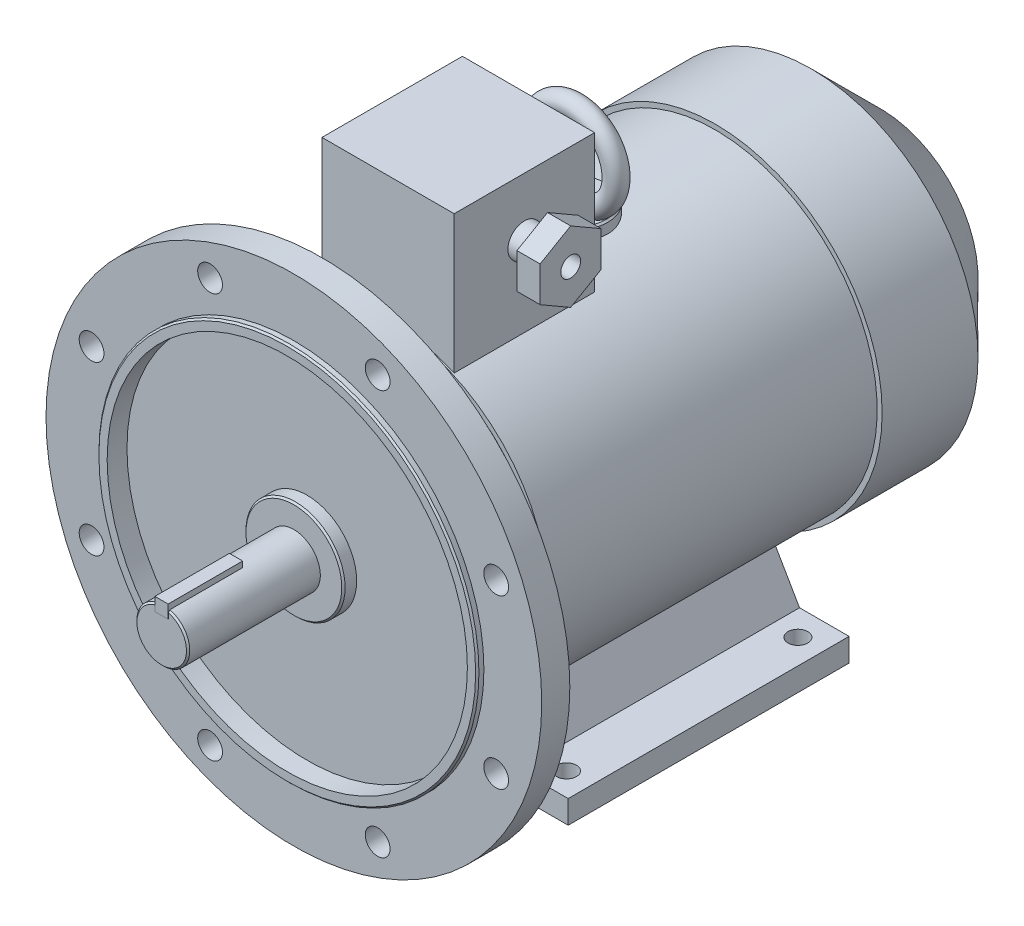
from build123d import *

# Parameters (mm, degrees)
SKETCH_1_R           = 16
EXTRUDE_1_DEPTH      = 80
SKETCH_2_R           = 150
EXTRUDE_2_DEPTH      = 17
EXTRUDE_3_DEPTH      = 0.1
EXTRUDE_3_DEPTH_BACK = 45
SKETCH_3_W           = 8
SKETCH_3_H           = 8
SKETCH_4_R           = 115
SKETCH_4_R_2         = 109
EXTRUDE_4_DEPTH      = 4
CUT_EXTRUDE_START    = -8
SKETCH_5_R           = 109
SKETCH_5_R_2         = 30
CUT_EXTRUDE_1_DEPTH  = 8
CHAMFER_1_SIZE       = 1
SKETCH_6_R           = 7.5
CUT_EXTRUDE_2_DEPTH  = 227.750986767
SKETCH_7_R           = 95
EXTRUDE_5_DEPTH      = 39
SKETCH_8_R           = 98
EXTRUDE_6_DEPTH      = 199
SKETCH_9_R           = 101
EXTRUDE_7_DEPTH      = 100
CHAMFER_2_SIZE       = 42
EXTRUDE_8_DEPTH      = 170
CUT_EXTRUDE_3_REACH  = 468.014
SKETCH_11_R          = 6
SKETCH_12_W          = 80
SKETCH_12_H          = 85
EXTRUDE_9_DEPTH      = 173
SKETCH_13_R          = 20
EXTRUDE_10_DEPTH     = 103
CHAMFER_3_SIZE       = 1
SKETCH_15_R          = 6
SKETCH_16_R          = 10
EXTRUDE_11_DEPTH     = 14
EXTRUDE_12_DEPTH     = 14
SKETCH_18_R          = 6
CUT_EXTRUDE_4_DEPTH  = 14


with BuildPart() as part:
    # Эскиз1 → Вытянуть1 (new body)
    with BuildSketch(Plane.XY):
        Circle(SKETCH_1_R)
    extrude(amount=EXTRUDE_1_DEPTH)

    # Эскиз2 → Вытянуть2 (add)
    with BuildSketch(Plane(origin=(0, 0, 0), x_dir=(-1, 0, 0), z_dir=(0, 0, -1))):
        Circle(SKETCH_2_R)
    extrude(amount=EXTRUDE_2_DEPTH)

    # Эскиз3 → Вытянуть3 (add, two sides: drawn at the far end of the back side and taken through both)
    with BuildSketch(Plane.XY.offset(80).offset(-EXTRUDE_3_DEPTH_BACK)):
        with Locations((0, 15)):
            Rectangle(SKETCH_3_W, SKETCH_3_H)
    extrude(amount=EXTRUDE_3_DEPTH + EXTRUDE_3_DEPTH_BACK)

    # Эскиз4 → Вытянуть4 (add)
    with BuildSketch(Plane.XY):
        with Locations(Location((0, 0, 0), (0, 0, 180))):
            Circle(SKETCH_4_R)
        Circle(SKETCH_4_R_2, mode=Mode.SUBTRACT)
    extrude(amount=EXTRUDE_4_DEPTH)

    # Эскиз5 → Вырез-Вытянуть1 (cut)
    with BuildSketch(Plane.XY.offset(CUT_EXTRUDE_START)):
        Circle(SKETCH_5_R)
        Circle(SKETCH_5_R_2, mode=Mode.SUBTRACT)
    extrude(amount=CUT_EXTRUDE_1_DEPTH, mode=Mode.SUBTRACT)

    # Фаска1
    chamfer_1_edges = [part.edges().sort_by_distance(p)[0] for p in [
        (115, 0, 4),
        (-30, 0, 0),
        (-9.797958971, -12.649110641, 80),
    ]]
    chamfer(chamfer_1_edges, length=CHAMFER_1_SIZE)

    # Эскиз6 → Вырез-Вытянуть2 (cut, through all)
    with BuildSketch(Plane.XY):
        with Locations((-50.705554788, 122.414038058)):
            Circle(SKETCH_6_R)
        with Locations((50.705554788, 122.414038058)):
            Circle(SKETCH_6_R)
        with Locations((122.414038058, 50.705554788)):
            Circle(SKETCH_6_R)
        with Locations((122.414038058, -50.705554788)):
            Circle(SKETCH_6_R)
        with Locations((50.705554788, -122.414038058)):
            Circle(SKETCH_6_R)
        with Locations((-50.705554788, -122.414038058)):
            Circle(SKETCH_6_R)
        with Locations((-122.414038058, -50.705554788)):
            Circle(SKETCH_6_R)
        with Locations((-122.414038058, 50.705554788)):
            Circle(SKETCH_6_R)
    extrude(amount=-CUT_EXTRUDE_2_DEPTH, mode=Mode.SUBTRACT)

    # Эскиз7 → Вытянуть5 (add)
    with BuildSketch(Plane(origin=(0, 0, -17), x_dir=(-1, 0, 0), z_dir=(0, 0, -1))):
        Circle(SKETCH_7_R)
    extrude(amount=EXTRUDE_5_DEPTH)

    # Эскиз8 → Вытянуть6 (add)
    with BuildSketch(Plane(origin=(0, 0, -56), x_dir=(-1, 0, 0), z_dir=(0, 0, -1))):
        Circle(SKETCH_8_R)
    extrude(amount=EXTRUDE_6_DEPTH)

    # Эскиз9 → Вытянуть7 (add)
    with BuildSketch(Plane(origin=(0, 0, -255), x_dir=(-1, 0, 0), z_dir=(0, 0, -1))):
        Circle(SKETCH_9_R)
    extrude(amount=EXTRUDE_7_DEPTH)

    # Фаска2
    chamfer_2_edges = [part.edges().sort_by_distance(p)[0] for p in [
        (101, 0, -355),
    ]]
    chamfer(chamfer_2_edges, length=CHAMFER_2_SIZE)

    # Эскиз10 → Вытянуть8 (add)
    with BuildSketch(Plane.XY.offset(-56)):
        Polygon((-110, -112), (-71.917096231, -112), (-51.440399562, -76.533320997), (-63.564755215, -69.533320997), (-80, -98), (-110, -98), align=None)
        Polygon((110, -98), (110, -112), (71.917096231, -112), (51.440399562, -76.533320997), (63.564755215, -69.533320997), (80, -98), align=None)
    extrude(amount=-EXTRUDE_8_DEPTH)

    # Эскиз11 → Вырез-Вытянуть3 (cut, up to next)
    with BuildSketch(Plane.XZ.offset(112), mode=Mode.PRIVATE) as cut_extrude_3_sk1:
        with Locations(Location((95, -70, 0), (0, 0, 270))):
            Circle(SKETCH_11_R)
    cut_extrude_3_tool1 = extrude(cut_extrude_3_sk1.sketch, amount=-CUT_EXTRUDE_3_REACH, mode=Mode.PRIVATE) & part.part
    # Эскиз11 → Вырез-Вытянуть3 (cut, up to next)
    with BuildSketch(Plane.XZ.offset(112), mode=Mode.PRIVATE) as cut_extrude_3_sk2:
        with Locations(Location((-95, -70, 0), (0, 0, 270))):
            Circle(SKETCH_11_R)
    cut_extrude_3_tool2 = extrude(cut_extrude_3_sk2.sketch, amount=-CUT_EXTRUDE_3_REACH, mode=Mode.PRIVATE) & part.part
    # Эскиз11 → Вырез-Вытянуть3 (cut, up to next)
    with BuildSketch(Plane.XZ.offset(112), mode=Mode.PRIVATE) as cut_extrude_3_sk3:
        with Locations(Location((95, -210, 0), (0, 0, 270))):
            Circle(SKETCH_11_R)
    cut_extrude_3_tool3 = extrude(cut_extrude_3_sk3.sketch, amount=-CUT_EXTRUDE_3_REACH, mode=Mode.PRIVATE) & part.part
    # Эскиз11 → Вырез-Вытянуть3 (cut, up to next)
    with BuildSketch(Plane.XZ.offset(112), mode=Mode.PRIVATE) as cut_extrude_3_sk4:
        with Locations(Location((-95, -210, 0), (0, 0, 270))):
            Circle(SKETCH_11_R)
    cut_extrude_3_tool4 = extrude(cut_extrude_3_sk4.sketch, amount=-CUT_EXTRUDE_3_REACH, mode=Mode.PRIVATE) & part.part
    add(cut_extrude_3_tool1.solids().sort_by_distance((95, -112, -70))[0], mode=Mode.SUBTRACT)
    add(cut_extrude_3_tool2.solids().sort_by_distance((-95, -112, -70))[0], mode=Mode.SUBTRACT)
    add(cut_extrude_3_tool3.solids().sort_by_distance((95, -112, -210))[0], mode=Mode.SUBTRACT)
    add(cut_extrude_3_tool4.solids().sort_by_distance((-95, -112, -210))[0], mode=Mode.SUBTRACT)

    # Эскиз12 → Вытянуть9 (add)
    with BuildSketch(Plane(origin=(0, 0, 0), x_dir=(1, 0, 0), z_dir=(0, 1, 0))):
        with Locations((0, 99.5)):
            Rectangle(SKETCH_12_W, SKETCH_12_H)
    extrude(amount=EXTRUDE_9_DEPTH)

    # Эскиз13 → Вытянуть10 (add)
    with BuildSketch(Plane(origin=(0, 0, 0), x_dir=(1, 0, 0), z_dir=(0, 1, 0))):
        with Locations(Location((0, 170, 0), (0, 0, 90))):
            Circle(SKETCH_13_R)
    extrude(amount=EXTRUDE_10_DEPTH)

    # Фаска3
    chamfer_3_edges = [part.edges().sort_by_distance(p)[0] for p in [
        (0, 103, -150),
    ]]
    chamfer(chamfer_3_edges, length=CHAMFER_3_SIZE)

    # По траектории1: sweep along a path in Эскиз14
    with BuildLine(Plane.XY.offset(-170)) as sweep_1_path:
        CenterArc((0, 128), 25, 0, 360)
    # Эскиз15 → По траектории1 (sweep)
    with BuildSketch(Plane(origin=(0, 0, 0), x_dir=(0, 0, -1), z_dir=(1, 0, 0))):
        with Locations((170, 153)):
            Circle(SKETCH_15_R)
    sweep(path=sweep_1_path.line)

    # Эскиз16 → Вытянуть11 (add)
    with BuildSketch(Plane(origin=(40, 0, 0), x_dir=(0, 0, -1), z_dir=(1, 0, 0))):
        with Locations(Location((99.5, 138, 0), (0, 0, 180))):
            Circle(SKETCH_16_R)
    extrude(amount=EXTRUDE_11_DEPTH)

    # Эскиз17 → Вытянуть12 (add)
    with BuildSketch(Plane(origin=(54, 0, 0), x_dir=(0, 0, -1), z_dir=(1, 0, 0))):
        Polygon((99.5, 159.36195996), (81, 148.68097998), (81, 127.31902002), (99.5, 116.63804004), (118, 127.31902002), (118, 148.68097998), align=None)
    extrude(amount=EXTRUDE_12_DEPTH)

    # Эскиз18 → Вырез-Вытянуть4 (cut)
    with BuildSketch(Plane(origin=(68, 0, 0), x_dir=(0, 0, -1), z_dir=(1, 0, 0))):
        with Locations((99.5, 138)):
            Circle(SKETCH_18_R)
    extrude(amount=-CUT_EXTRUDE_4_DEPTH, mode=Mode.SUBTRACT)


solid = part.part
